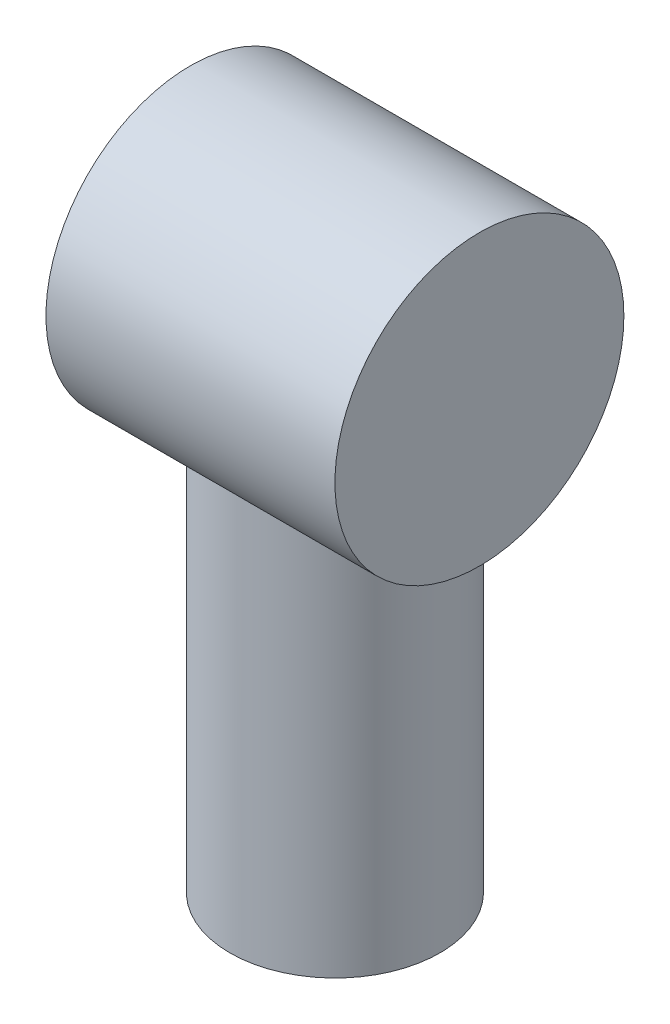
from build123d import *

# Parameters (mm, degrees)
SKETCH2_R           = 40
BOSS_EXTRUDE2_DEPTH = 190
SKETCH3_R           = 55
BOSS_EXTRUDE3_DEPTH = 55


with BuildPart() as part:
    # Sketch2 → Boss-Extrude2 (new body)
    with BuildSketch(Plane(origin=(0, 0, 0), x_dir=(1, 0, 0), z_dir=(0, 1, 0))):
        Circle(SKETCH2_R)
    extrude(amount=-BOSS_EXTRUDE2_DEPTH)

    # Sketch3 → Boss-Extrude3 (add, symmetric)
    with BuildSketch(Plane(origin=(0, 0, 0), x_dir=(0, 0, -1), z_dir=(1, 0, 0))):
        Circle(SKETCH3_R)
    extrude(amount=BOSS_EXTRUDE3_DEPTH, both=True)


solid = part.part
